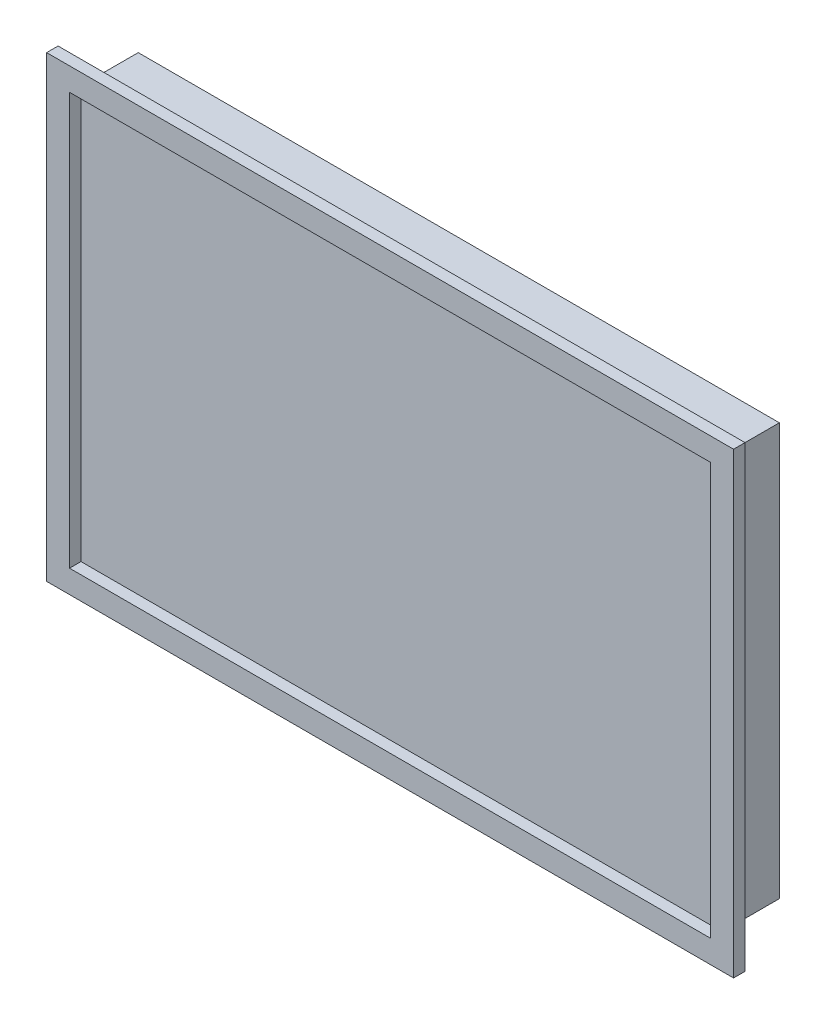
from build123d import *

# Parameters (mm, degrees)
SKETCH_1_W           = 300
SKETCH_1_H           = 200
EXTRUDE_1_DEPTH      = 30
SKETCH_2_W           = 280
SKETCH_2_H           = 180
CUT_EXTRUDE_1_DEPTH  = 5
SKETCH_3_OUTSIDE_W   = 374.36
SKETCH_3_OUTSIDE_H   = 274.36
SKETCH_3_OUTSIDE_W_2 = 280
SKETCH_3_OUTSIDE_H_2 = 180
CUT_EXTRUDE_2_DEPTH  = 25


with BuildPart() as part:
    # 草图1 → 凸台-拉伸1 (new body)
    with BuildSketch(Plane.XY):
        Rectangle(SKETCH_1_W, SKETCH_1_H)
    extrude(amount=EXTRUDE_1_DEPTH)

    # 草图2 → 切除-拉伸1 (cut)
    with BuildSketch(Plane.XY.offset(30)):
        Rectangle(SKETCH_2_W, SKETCH_2_H)
    extrude(amount=-CUT_EXTRUDE_1_DEPTH, mode=Mode.SUBTRACT)

    # 草图3 outside → 切除-拉伸2 (cut)
    with BuildSketch(Plane(origin=(0, 0, 0), x_dir=(-1, 0, 0), z_dir=(0, 0, -1))):
        Rectangle(SKETCH_3_OUTSIDE_W, SKETCH_3_OUTSIDE_H)
        Rectangle(SKETCH_3_OUTSIDE_W_2, SKETCH_3_OUTSIDE_H_2, mode=Mode.SUBTRACT)
    extrude(amount=-CUT_EXTRUDE_2_DEPTH, mode=Mode.SUBTRACT)


with BuildPart() as cut_extrude_2_piece_1:
    # of the separate pieces the step leaves, piece 1, a body of its own (cut_extrude_2_pieces)
    add(part.part.solids().sort_by_distance((-140, -90, 0))[0])


with BuildPart() as cut_extrude_2_piece_2:
    # of the separate pieces the step leaves, piece 2, a body of its own (cut_extrude_2_pieces)
    add(part.part.solids().sort_by_distance((-150, -100, 25))[0])


solid = Compound([cut_extrude_2_piece_1.part, cut_extrude_2_piece_2.part])
